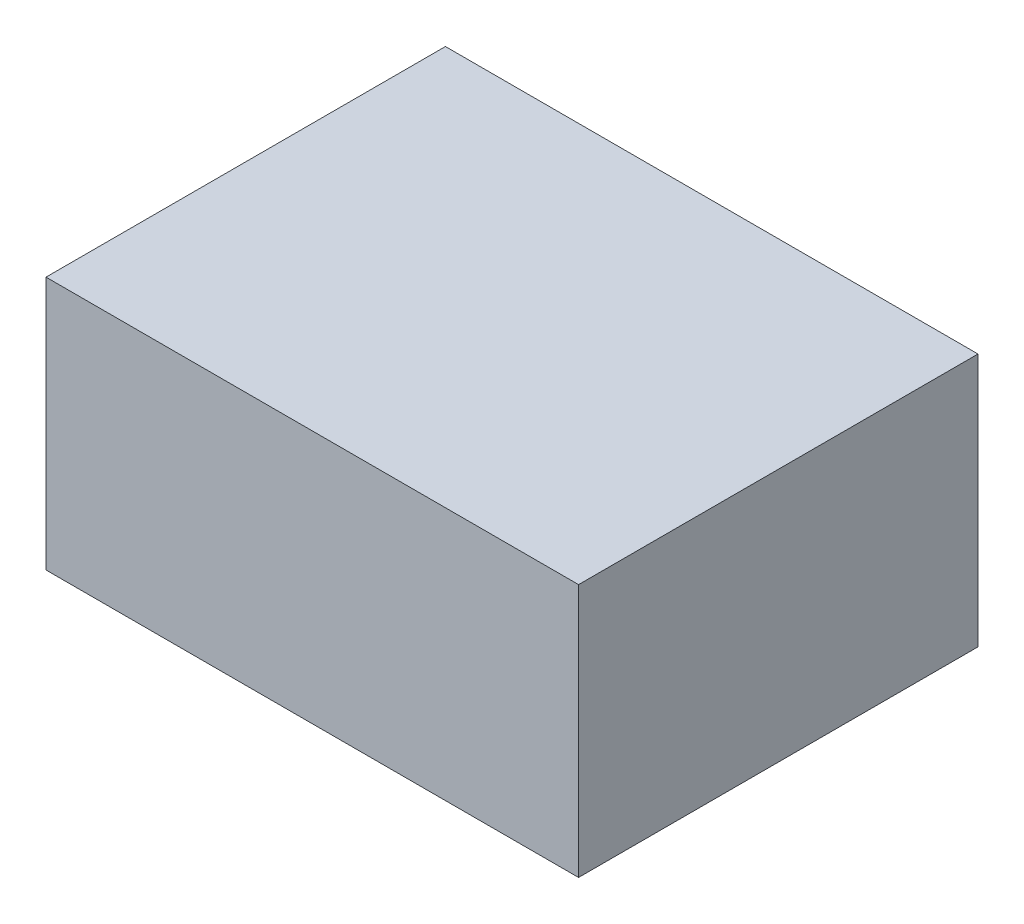
from build123d import *

# Parameters (mm, degrees)
SKETCH1_W           = 160
SKETCH1_H           = 120
BOSS_EXTRUDE1_DEPTH = 76.2


with BuildPart() as part:
    # Sketch1 → Boss-Extrude1 (new body)
    with BuildSketch(Plane(origin=(0, 0, 0), x_dir=(1, 0, 0), z_dir=(0, 1, 0))):
        Rectangle(SKETCH1_W, SKETCH1_H)
    extrude(amount=BOSS_EXTRUDE1_DEPTH)


solid = part.part
